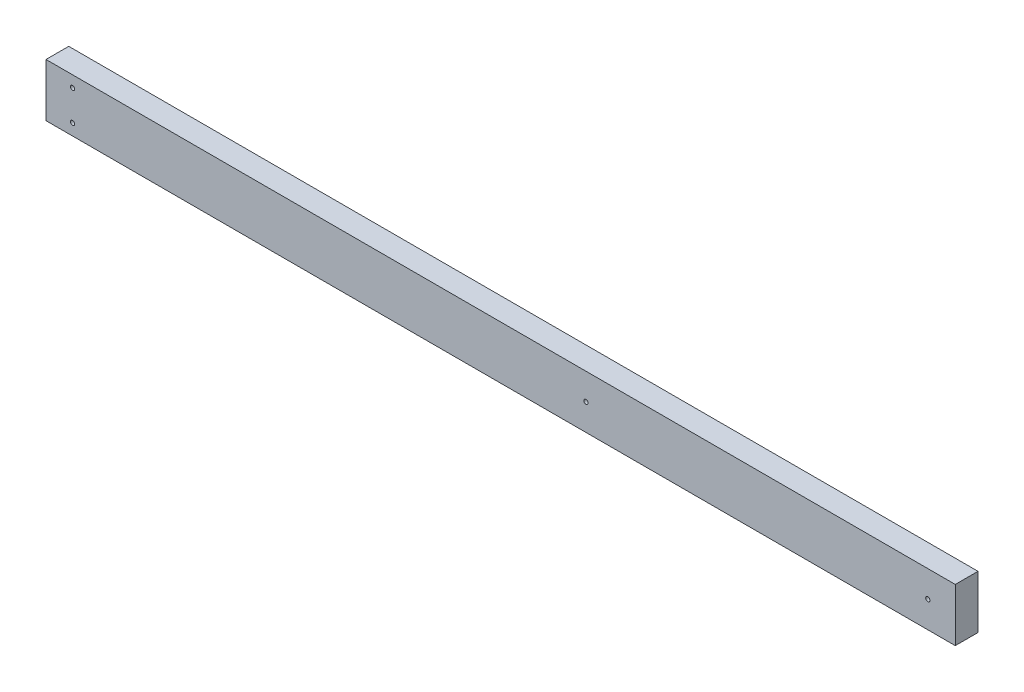
from build123d import *

# Parameters (mm, degrees)
SKETCH1_W           = 38.1
SKETCH1_H           = 88.9
BOSS_EXTRUDE1_DEPTH = 1524
SKETCH2_R           = 3.571875
CUT_EXTRUDE1_DEPTH  = 1528.066082395


with BuildPart() as part:
    # Sketch1 → Boss-Extrude1 (new body)
    with BuildSketch(Plane(origin=(0, 0, 0), x_dir=(0, 0, -1), z_dir=(1, 0, 0))):
        with Locations((19.05, 44.45)):
            Rectangle(SKETCH1_W, SKETCH1_H)
    extrude(amount=BOSS_EXTRUDE1_DEPTH)

    # Sketch2 → Cut-Extrude1 (cut, through all)
    with BuildSketch(Plane.XY):
        with Locations((44.45, 19.05)):
            Circle(SKETCH2_R)
        with Locations((1477.9625, 44.45)):
            Circle(SKETCH2_R)
        with Locations((44.45, 69.85)):
            Circle(SKETCH2_R)
        with Locations((904.875, 44.45)):
            Circle(SKETCH2_R)
    extrude(amount=-CUT_EXTRUDE1_DEPTH, mode=Mode.SUBTRACT)


solid = part.part
